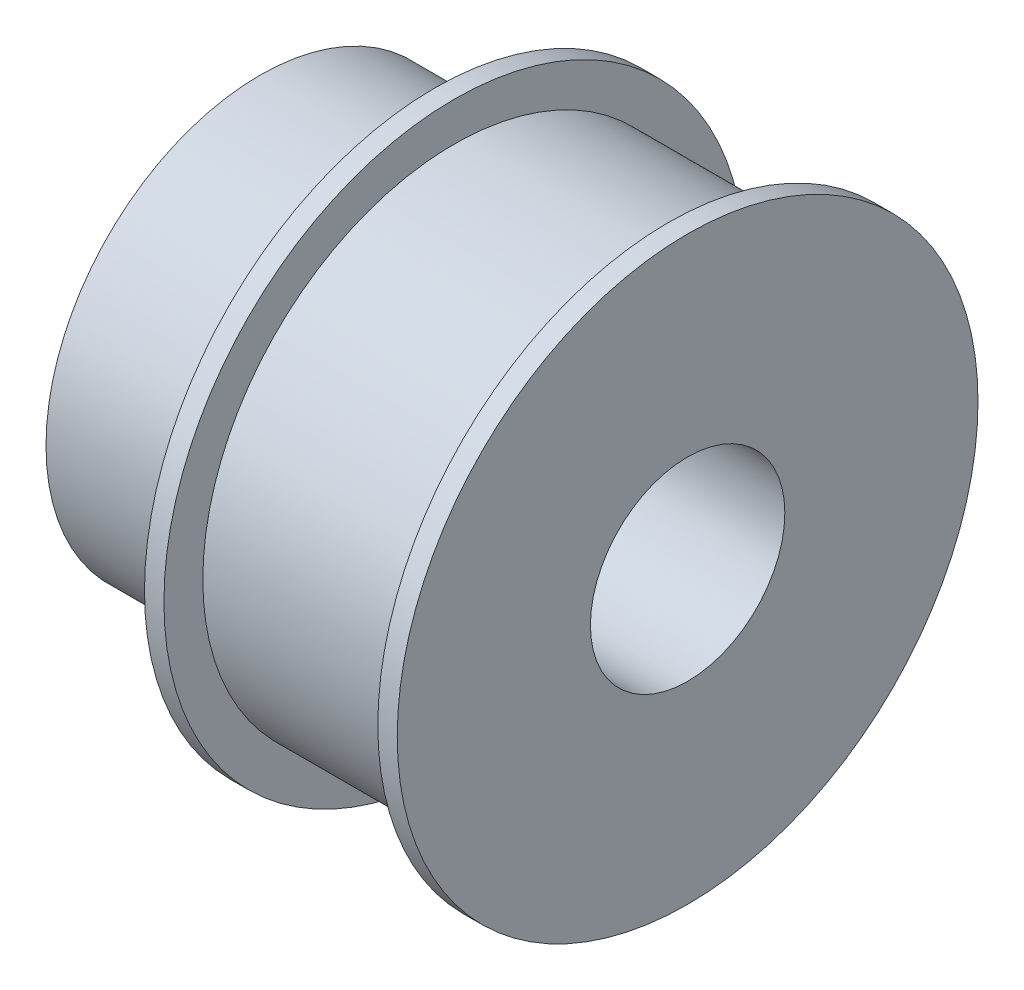
from build123d import *

# Parameters (mm, degrees)
SKETCH_1_R          = 12.935
EXTRUDE_1_DEPTH     = 11
SKETCH_2_R          = 14.935
EXTRUDE_2_DEPTH     = 1
EXTRUDE_START       = 1
SKETCH_3_R          = 14.935
EXTRUDE_3_DEPTH     = 1
SKETCH_4_R          = 11
EXTRUDE_4_DEPTH     = 9
SKETCH_5_R          = 5
CUT_EXTRUDE_1_DEPTH = 30


with BuildPart() as part:
    # 草图1 → 凸台-拉伸1 (new body)
    with BuildSketch(Plane(origin=(0, 0, 0), x_dir=(0, 0, -1), z_dir=(1, 0, 0))):
        Circle(SKETCH_1_R)
    extrude(amount=EXTRUDE_1_DEPTH)

    # 草图2 → 凸台-拉伸2 (add)
    with BuildSketch(Plane(origin=(11, 0, 0), x_dir=(0, 0, -1), z_dir=(1, 0, 0))):
        Circle(SKETCH_2_R)
    extrude(amount=EXTRUDE_2_DEPTH)

    # 草图3 → 凸台-拉伸3 (add)
    with BuildSketch(Plane.ZY.offset(EXTRUDE_START)):
        with Locations(Location((0, 0, 0), (0, 0, 180))):
            Circle(SKETCH_3_R)
    extrude(amount=-EXTRUDE_3_DEPTH)

    # 草图4 → 凸台-拉伸4 (add)
    with BuildSketch(Plane.ZY.offset(1)):
        with Locations(Location((0, 0, 0), (0, 0, 180))):
            Circle(SKETCH_4_R)
    extrude(amount=EXTRUDE_4_DEPTH)

    # 草图5 → 切除-拉伸1 (cut)
    with BuildSketch(Plane.ZY.offset(10)):
        Circle(SKETCH_5_R)
    extrude(amount=-CUT_EXTRUDE_1_DEPTH, mode=Mode.SUBTRACT)


solid = part.part
